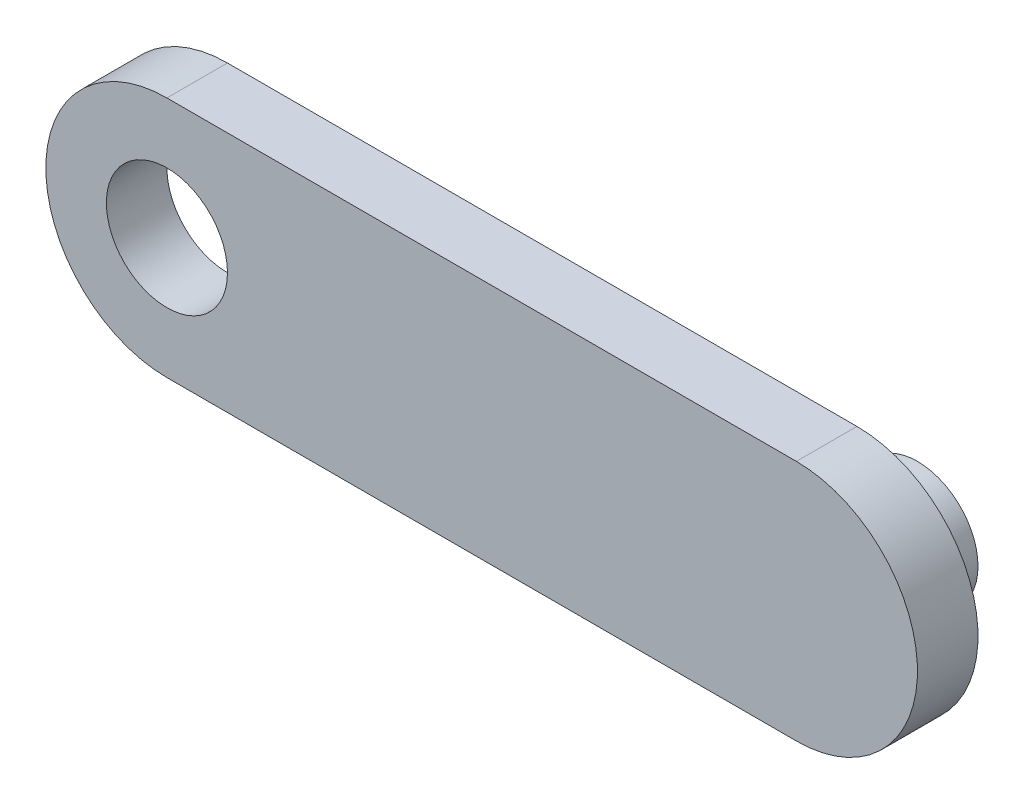
from build123d import *

# Parameters (mm, degrees)
SKETCH_1_R      = 10
EXTRUDE_1_DEPTH = 10
SKETCH_2_R      = 10
EXTRUDE_2_DEPTH = 10


with BuildPart() as part:
    # 스케치1 → 보스-돌출1 (new body)
    with BuildSketch(Plane.XY):
        with BuildLine():
            Line((0, 20), (103.959759811, 20))
            ThreePointArc((103.959759811, 20), (123.959759811, 0), (103.959759811, -20))
            Line((103.959759811, -20), (0, -20))
            ThreePointArc((0, -20), (-20, 0), (0, 20))
        make_face()
        Circle(SKETCH_1_R, mode=Mode.SUBTRACT)
    extrude(amount=EXTRUDE_1_DEPTH)

    # 스케치2 → 보스-돌출2 (add)
    with BuildSketch(Plane(origin=(0, 0, 0), x_dir=(-1, 0, 0), z_dir=(0, 0, -1))):
        with Locations(Location((-103.959759811, 0, 0), (0, 0, 180))):
            Circle(SKETCH_2_R)
    extrude(amount=EXTRUDE_2_DEPTH)


solid = part.part
